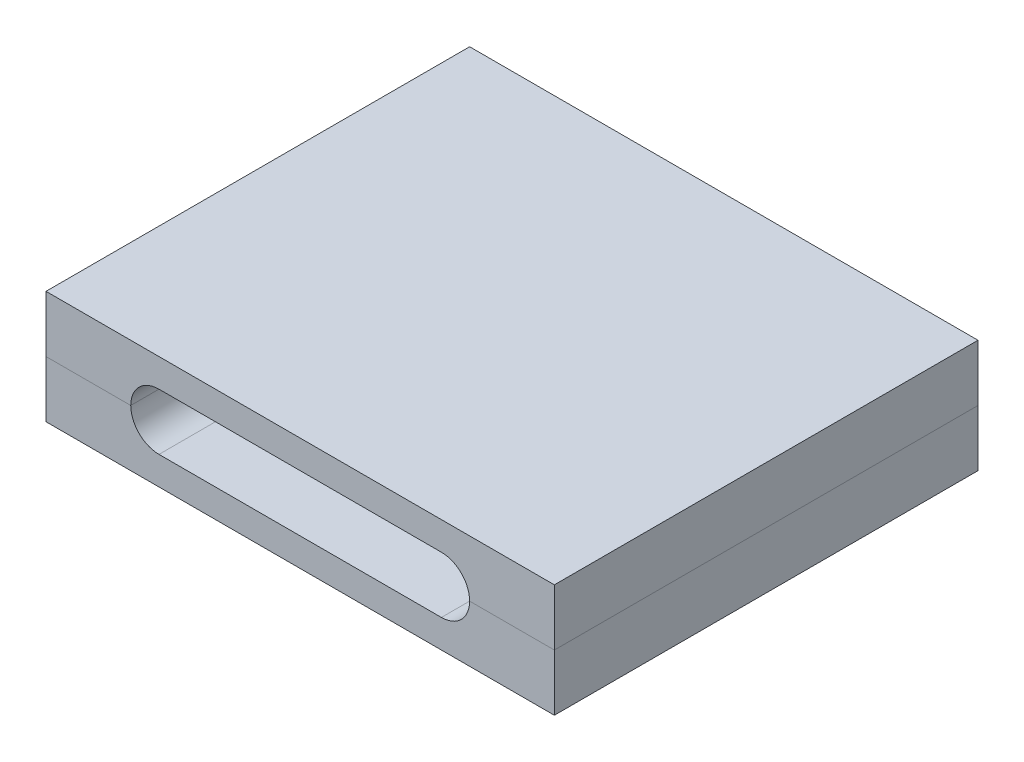
from build123d import *

# Parameters (mm, degrees)
SKETCH_2_W                     = 18
SKETCH_2_H                     = 4
EXTRUDE_1_DEPTH                = 15
CUT_EXTRUDE_1_DEPTH            = 15
SPLIT_BODIES_1_SURFACE_1_BACK  = 24.77
SPLIT_BODIES_1_SURFACE_1_DEPTH = 49.54
SPLIT_BODIES_1_SURFACE_2_BACK  = 24.77
SPLIT_BODIES_1_SURFACE_2_DEPTH = 49.54


with BuildPart() as part:
    # 스케치2 → 보스-돌출1 (new body)
    with BuildSketch(Plane.XY):
        Rectangle(SKETCH_2_W, SKETCH_2_H)
    extrude(amount=EXTRUDE_1_DEPTH)

    # 스케치1 → 컷-돌출1 (cut)
    with BuildSketch(Plane.XY):
        with BuildLine():
            Line((-5, 1), (5, 1))
            ThreePointArc((5, 1), (6, 0), (5, -1))
            Line((5, -1), (-5, -1))
            ThreePointArc((-5, -1), (-6, 0), (-5, 1))
        make_face()
    extrude(amount=CUT_EXTRUDE_1_DEPTH, mode=Mode.SUBTRACT)


with BuildPart() as body_2:
    # Split Bodies 1: the piece behind the surface
    add(part.part)
    # Split Bodies 1 surface: a surface, the sketch's curves swept straight by 49.54 mm
    with BuildLine(Plane.XY.offset(15).offset(-SPLIT_BODIES_1_SURFACE_1_BACK), mode=Mode.PRIVATE) as split_bodies_1_surface_1_path:
        Line((9, 0), (-9, 0))
    split_bodies_1_surface_1 = Shell.extrude(split_bodies_1_surface_1_path.wire(), (0 * SPLIT_BODIES_1_SURFACE_1_DEPTH, 0 * SPLIT_BODIES_1_SURFACE_1_DEPTH, 1 * SPLIT_BODIES_1_SURFACE_1_DEPTH))
    split(bisect_by=split_bodies_1_surface_1, keep=Keep.BOTTOM)


with BuildPart() as part_1:
    add(part.part)

    # Split Bodies 1: split by a surface, the side it looks to stays
    # Split Bodies 1 surface: a surface, the sketch's curves swept straight by 49.54 mm
    with BuildLine(Plane.XY.offset(15).offset(-SPLIT_BODIES_1_SURFACE_2_BACK), mode=Mode.PRIVATE) as split_bodies_1_surface_2_path:
        Line((9, 0), (-9, 0))
    split_bodies_1_surface_2 = Shell.extrude(split_bodies_1_surface_2_path.wire(), (0 * SPLIT_BODIES_1_SURFACE_2_DEPTH, 0 * SPLIT_BODIES_1_SURFACE_2_DEPTH, 1 * SPLIT_BODIES_1_SURFACE_2_DEPTH))
    split(bisect_by=split_bodies_1_surface_2, keep=Keep.TOP)


solid = Compound([body_2.part, part_1.part])
